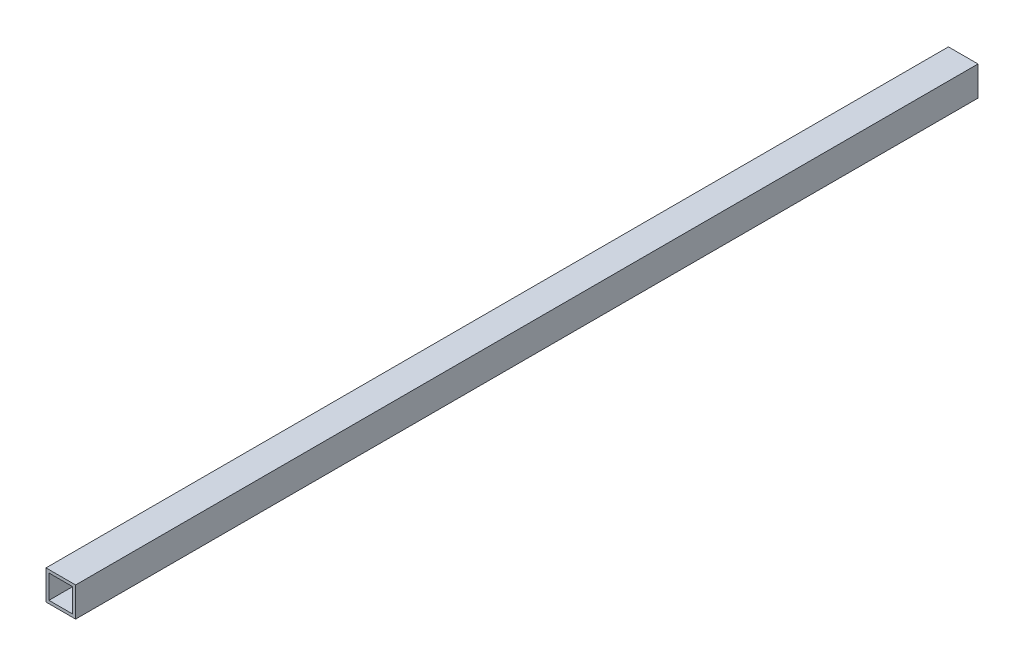
from build123d import *

# Parameters (mm, degrees)
BOSS_EXTRUDE1_DEPTH      = 304.8
BOSS_EXTRUDE1_DEPTH_BACK = 304.8
SKETCH3_W                = 20
SKETCH3_H                = 20
SKETCH3_W_2              = 16
SKETCH3_H_2              = 16


with BuildPart() as part:
    # Sketch3 → Boss-Extrude1 (new, two sides: drawn at the far end of the back side and taken through both)
    with BuildSketch(Plane.XY.offset(-BOSS_EXTRUDE1_DEPTH_BACK)):
        Rectangle(SKETCH3_W, SKETCH3_H)
        Rectangle(SKETCH3_W_2, SKETCH3_H_2, mode=Mode.SUBTRACT)
    extrude(amount=BOSS_EXTRUDE1_DEPTH + BOSS_EXTRUDE1_DEPTH_BACK)


solid = part.part
